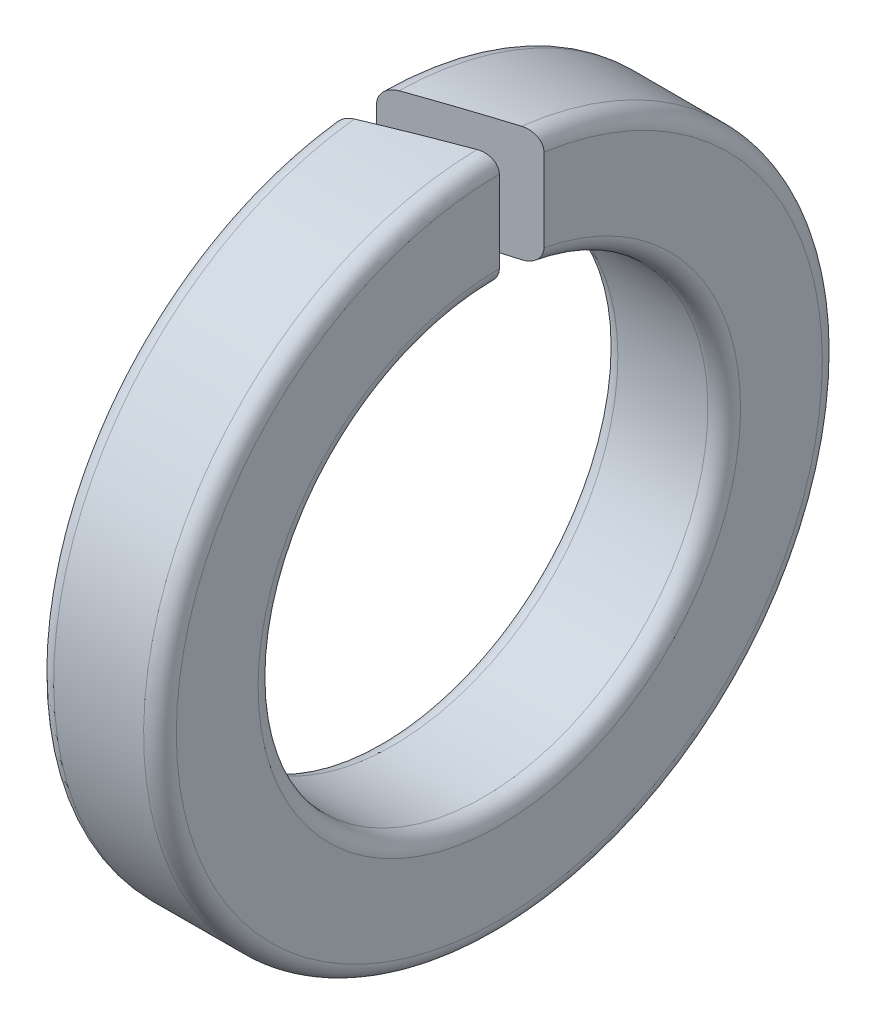
from build123d import *

# Parameters (mm, degrees)
ESQUISSE1_W             = 1.5
ESQUISSE1_H             = 1.4
ENL_V_MAT_EXTRU_1_DEPTH = 7.057639804
CONG_1_R                = 0.2


with BuildPart() as part:
    # Esquisse1 → Base-Révolution (revolve)
    with BuildSketch(Plane(origin=(0, 0, 0), x_dir=(1, 0, 0), z_dir=(0, 1, 0))):
        with Locations((0.75, 3.45)):
            Rectangle(ESQUISSE1_W, ESQUISSE1_H)
    revolve(axis=Axis((0, 0, 0), (1, 0, 0)))

    # Esquisse2 → Enlèv. mat.-Extru.1 (cut, through all)
    with BuildSketch(Plane(origin=(0, 0, 0), x_dir=(1, 0, 0), z_dir=(0, 1, 0))):
        Polygon((0, 0), (1.5, 0.545955351), (1.5, 0), (0, -0.545955351), align=None)
    extrude(amount=ENL_V_MAT_EXTRU_1_DEPTH, mode=Mode.SUBTRACT)

    # Congé1
    cong_1_edges = [part.edges().sort_by_distance(p)[0] for p in [
        (1.5, -2.934493142, 2.934493142),
        (0, -3.121555278, 2.734664997),
        (1.5, -1.944543648, 1.944543648),
        (0, -2.128835035, 1.740850767),
    ]]
    fillet(cong_1_edges, radius=CONG_1_R)


solid = part.part
